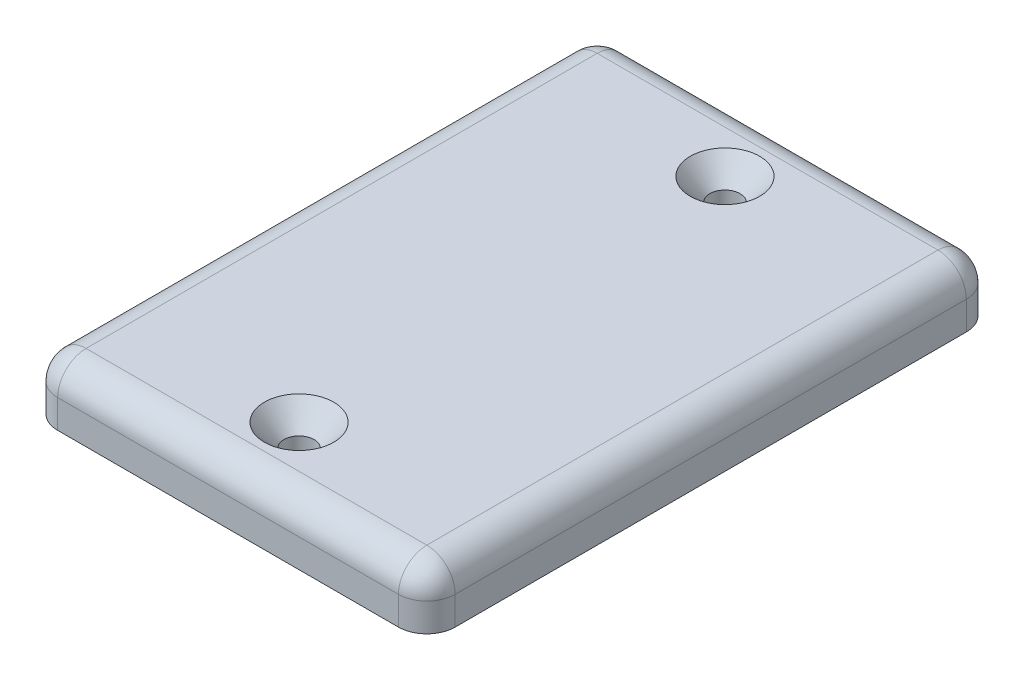
from build123d import *

# Parameters (mm, degrees)
SKETCH1_W                                        = 88.9
SKETCH1_H                                        = 127
BOSS_EXTRUDE1_DEPTH                              = 12.7
CSK_FOR_1_4_FLAT_HEAD_MACHINE_SCREW1_D           = 6.7564
CSK_FOR_1_4_FLAT_HEAD_MACHINE_SCREW1_CSINK_D     = 15.5273756
CSK_FOR_1_4_FLAT_HEAD_MACHINE_SCREW1_CSINK_ANGLE = 82
FILLET1_R                                        = 6.35
FILLET2_R                                        = 6.35


with BuildPart() as part:
    # Sketch1 → Boss-Extrude1 (new body)
    with BuildSketch(Plane(origin=(0, 0, 0), x_dir=(1, 0, 0), z_dir=(0, 1, 0))):
        with Locations((44.45, 63.5)):
            Rectangle(SKETCH1_W, SKETCH1_H)
    extrude(amount=BOSS_EXTRUDE1_DEPTH)

    # CSK for 1/4 Flat Head Machine Screw1 (through all)
    with Locations(Plane(origin=(0, 12.7, 0), x_dir=(-1, 0, 0), z_dir=(0, 1, 0))):
        with Locations((-44.45, -15.875), (-44.45, -111.125)):
            CounterSinkHole(CSK_FOR_1_4_FLAT_HEAD_MACHINE_SCREW1_D / 2, CSK_FOR_1_4_FLAT_HEAD_MACHINE_SCREW1_CSINK_D / 2, counter_sink_angle=CSK_FOR_1_4_FLAT_HEAD_MACHINE_SCREW1_CSINK_ANGLE)

    # Fillet1
    fillet1_edges = [part.edges().sort_by_distance(p)[0] for p in [
        (0, 6.35, -127),
        (88.9, 6.35, -127),
        (88.9, 6.35, 0),
        (0, 6.35, 0),
    ]]
    fillet(fillet1_edges, radius=FILLET1_R)

    # Fillet2
    fillet2_edges = [part.edges().sort_by_distance(p)[0] for p in [
        (44.45, 12.7, 0),
        (0, 12.7, -63.5),
        (88.9, 12.7, -63.5),
        (44.45, 12.7, -127),
        (87.040128061, 12.7, -125.140128061),
        (87.040128061, 12.7, -1.859871939),
        (1.859871939, 12.7, -125.140128061),
        (1.859871939, 12.7, -1.859871939),
    ]]
    fillet(fillet2_edges, radius=FILLET2_R)


solid = part.part
